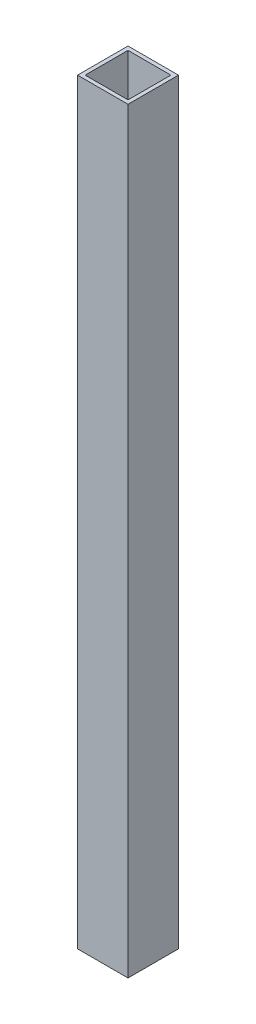
from build123d import *

# Parameters (mm, degrees)
SKETCH_1_W      = 20
SKETCH_1_H      = 20
SKETCH_1_W_2    = 17
SKETCH_1_H_2    = 17
EXTRUDE_1_DEPTH = 300


with BuildPart() as part:
    # Эскиз1 → Бобышка-Вытянуть1 (new body)
    with BuildSketch(Plane(origin=(0, 0, 0), x_dir=(1, 0, 0), z_dir=(0, 1, 0))):
        Rectangle(SKETCH_1_W, SKETCH_1_H)
        Rectangle(SKETCH_1_W_2, SKETCH_1_H_2, mode=Mode.SUBTRACT)
    extrude(amount=EXTRUDE_1_DEPTH)


solid = part.part
